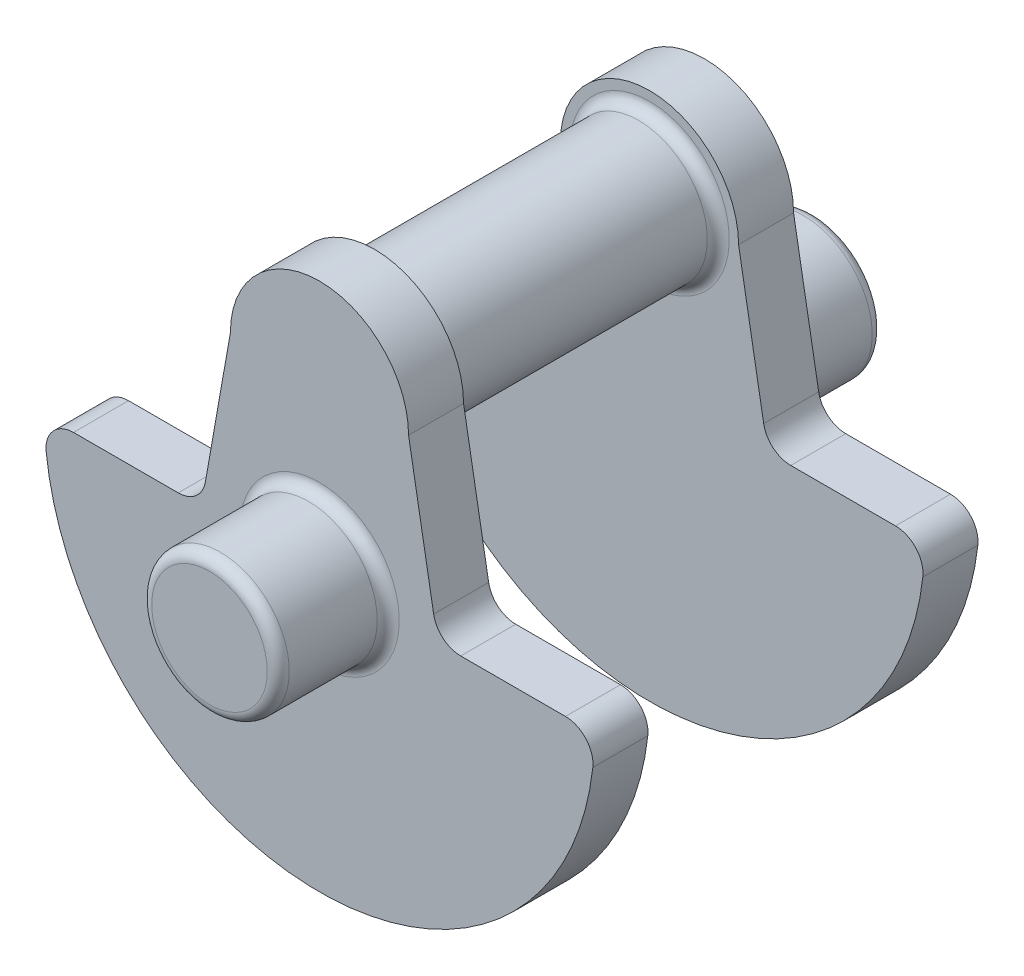
from build123d import *

# Parameters (mm, degrees)
BOSS_EXTRUDE1_DEPTH = 5
SKETCH2_R           = 12.5
BOSS_EXTRUDE2_DEPTH = 20
SKETCH3_R           = 12.5
BOSS_EXTRUDE3_DEPTH = 50
FILLET2_R           = 5
FILLET3_R           = 2


with BuildPart() as part:
    # Sketch1 → Boss-Extrude1 (new, symmetric)
    with BuildSketch(Plane.XY):
        with BuildLine():
            Line((-50, -30), (-21.483978407, -30))
            Line((-21.483978407, -30), (-16.194168986, 0))
            ThreePointArc((-16.194168986, 0), (0, 16.194168986), (16.194168986, 0))
            Line((16.194168986, 0), (21.483978407, -30))
            Line((21.483978407, -30), (50, -30))
            ThreePointArc((50, -30), (0, -80), (-50, -30))
        make_face()
    boss_extrude1 = extrude(amount=BOSS_EXTRUDE1_DEPTH, both=True)

    # Sketch2 → Boss-Extrude2 (add)
    with BuildSketch(Plane.XY.offset(5)):
        with Locations((0, -30)):
            Circle(SKETCH2_R)
    boss_extrude2 = extrude(amount=BOSS_EXTRUDE2_DEPTH)

    # Sketch3 → Boss-Extrude3 (add)
    with BuildSketch(Plane(origin=(0, 0, -5), x_dir=(-1, 0, 0), z_dir=(0, 0, -1))):
        with Locations(Location((0, 0, 0), (0, 0, 180))):
            Circle(SKETCH3_R)
    extrude(amount=BOSS_EXTRUDE3_DEPTH)

    # Mirror1: Boss-Extrude1, Boss-Extrude2 across plane
    add(boss_extrude1.mirror(Plane(origin=(0, 0, -30), x_dir=(1, 0, 0), z_dir=(0, 0, -1))))
    add(boss_extrude2.mirror(Plane(origin=(0, 0, -30), x_dir=(1, 0, 0), z_dir=(0, 0, -1))))

    # Fillet2
    fillet2_edges = [part.edges().sort_by_distance(p)[0] for p in [
        (21.483978407, -30, 0),
        (50, -30, 0),
        (-50, -30, 0),
        (-21.483978407, -30, 0),
        (21.483978407, -30, -60),
        (50, -30, -60),
        (-50, -30, -60),
        (-21.483978407, -30, -60),
    ]]
    fillet(fillet2_edges, radius=FILLET2_R)

    # Fillet3
    fillet3_edges = [part.edges().sort_by_distance(p)[0] for p in [
        (-12.5, -30, 5),
        (-12.5, -30, 25),
        (-12.5, 0, -5),
        (-12.5, 0, -55),
        (-12.5, -30, -65),
        (-12.5, -30, -85),
    ]]
    fillet(fillet3_edges, radius=FILLET3_R)


solid = part.part
